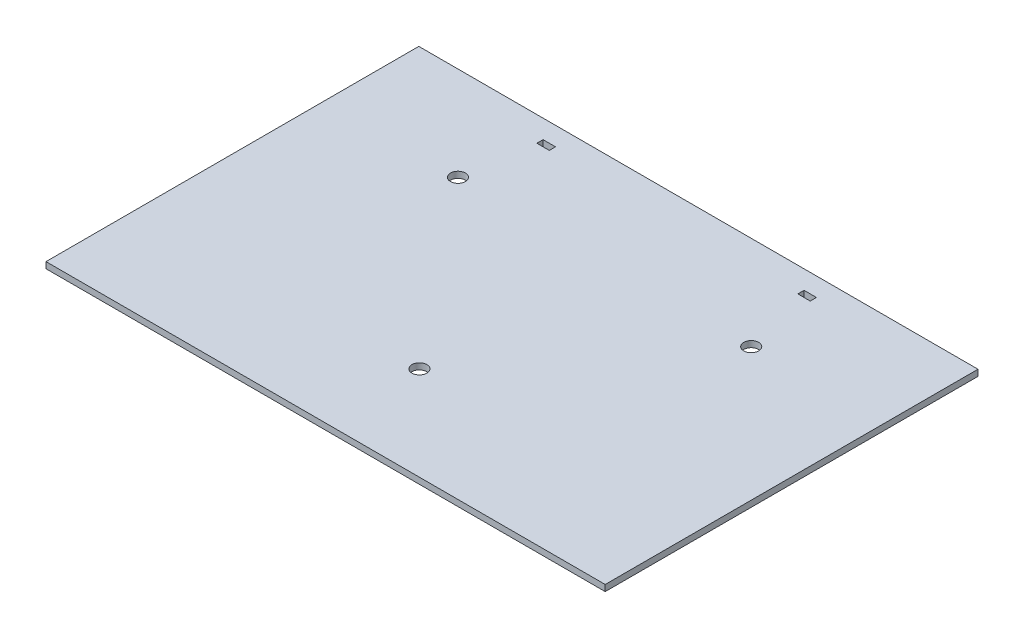
from build123d import *

# Parameters (mm, degrees)
SKETCH1_W      = 450
SKETCH1_H      = 300
EXTRUDE1_DEPTH = 5
EXTRUDE2_REACH = 272.463
SKETCH2_R      = 6
EXTRUDE3_REACH = 272.463
SKETCH3_W      = 10
SKETCH3_H      = 5


with BuildPart() as part:
    # Sketch1 → Extrude1 (new body)
    with BuildSketch(Plane(origin=(0, 0, 0), x_dir=(1, 0, 0), z_dir=(0, 1, 0))):
        Rectangle(SKETCH1_W, SKETCH1_H)
    extrude(amount=-EXTRUDE1_DEPTH)

    # Sketch2 → Extrude2 (cut, up to next)
    with BuildSketch(Plane(origin=(0, 0, 0), x_dir=(1, 0, 0), z_dir=(0, 1, 0)), mode=Mode.PRIVATE) as extrude2_sk1:
        with Locations(Location((0, -74.5, 0), (0, 0, 270))):
            Circle(SKETCH2_R)
    extrude2_tool1 = extrude(extrude2_sk1.sketch, amount=-EXTRUDE2_REACH, mode=Mode.PRIVATE) & part.part
    # Sketch2 → Extrude2 (cut, up to next)
    with BuildSketch(Plane(origin=(0, 0, 0), x_dir=(1, 0, 0), z_dir=(0, 1, 0)), mode=Mode.PRIVATE) as extrude2_sk2:
        with Locations(Location((118, 74.5, 0), (0, 0, 270))):
            Circle(SKETCH2_R)
    extrude2_tool2 = extrude(extrude2_sk2.sketch, amount=-EXTRUDE2_REACH, mode=Mode.PRIVATE) & part.part
    # Sketch2 → Extrude2 (cut, up to next)
    with BuildSketch(Plane(origin=(0, 0, 0), x_dir=(1, 0, 0), z_dir=(0, 1, 0)), mode=Mode.PRIVATE) as extrude2_sk3:
        with Locations(Location((-118, 74.5, 0), (0, 0, 270))):
            Circle(SKETCH2_R)
    extrude2_tool3 = extrude(extrude2_sk3.sketch, amount=-EXTRUDE2_REACH, mode=Mode.PRIVATE) & part.part
    add(extrude2_tool1.solids().sort_by_distance((0, 0, 74.5))[0], mode=Mode.SUBTRACT)
    add(extrude2_tool2.solids().sort_by_distance((118, 0, -74.5))[0], mode=Mode.SUBTRACT)
    add(extrude2_tool3.solids().sort_by_distance((-118, 0, -74.5))[0], mode=Mode.SUBTRACT)

    # Sketch3 → Extrude3 (cut, up to next)
    with BuildSketch(Plane(origin=(0, 0, 0), x_dir=(1, 0, 0), z_dir=(0, 1, 0)), mode=Mode.PRIVATE) as extrude3_sk1:
        with Locations((-105, 132.5)):
            Rectangle(SKETCH3_W, SKETCH3_H)
    extrude3_tool1 = extrude(extrude3_sk1.sketch, amount=-EXTRUDE3_REACH, mode=Mode.PRIVATE) & part.part
    # Sketch3 → Extrude3 (cut, up to next)
    with BuildSketch(Plane(origin=(0, 0, 0), x_dir=(1, 0, 0), z_dir=(0, 1, 0)), mode=Mode.PRIVATE) as extrude3_sk2:
        with Locations((105, 132.5)):
            Rectangle(SKETCH3_W, SKETCH3_H)
    extrude3_tool2 = extrude(extrude3_sk2.sketch, amount=-EXTRUDE3_REACH, mode=Mode.PRIVATE) & part.part
    add(extrude3_tool1.solids().sort_by_distance((-105, 0, -132.5))[0], mode=Mode.SUBTRACT)
    add(extrude3_tool2.solids().sort_by_distance((105, 0, -132.5))[0], mode=Mode.SUBTRACT)


solid = part.part
